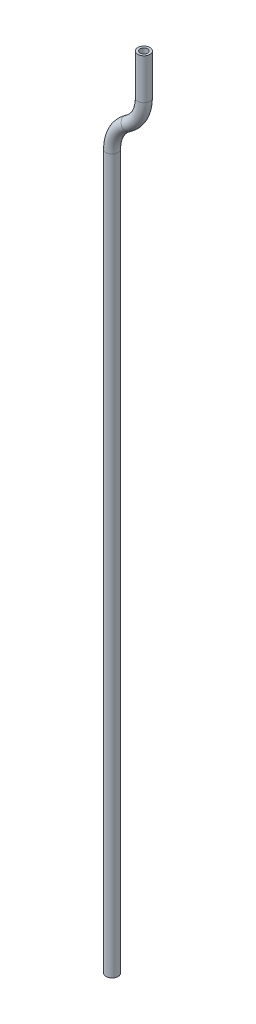
from build123d import *

# Parameters (mm, degrees)
UTILITY_CIRCULAR_CROSS_SECTION_R   = 2
UTILITY_CIRCULAR_CROSS_SECTION_R_2 = 1.25


with BuildPart() as part:
    # Native hollow utility sweep: sweep along a path in Illustrative smooth utility route
    with BuildLine(Plane.XY) as native_hollow_utility_sweep_path:
        Line((13.55, 0), (13.55, -13.5))
        ThreePointArc((13.55, -13.5), (12.150414231, -19.152999757), (8.275, -23.5))
        ThreePointArc((8.275, -23.5), (4.399585769, -27.847000243), (3, -33.5))
        Line((3, -33.5), (3, -270.5))
    # Utility circular cross section → Native hollow utility sweep (sweep)
    with BuildSketch(Plane(origin=(0, 0, 0), x_dir=(1, 0, 0), z_dir=(0, 1, 0))):
        with Locations((13.55, 0)):
            Circle(UTILITY_CIRCULAR_CROSS_SECTION_R)
        with Locations((13.55, 0)):
            Circle(UTILITY_CIRCULAR_CROSS_SECTION_R_2, mode=Mode.SUBTRACT)
    sweep(path=native_hollow_utility_sweep_path.line)


solid = part.part
